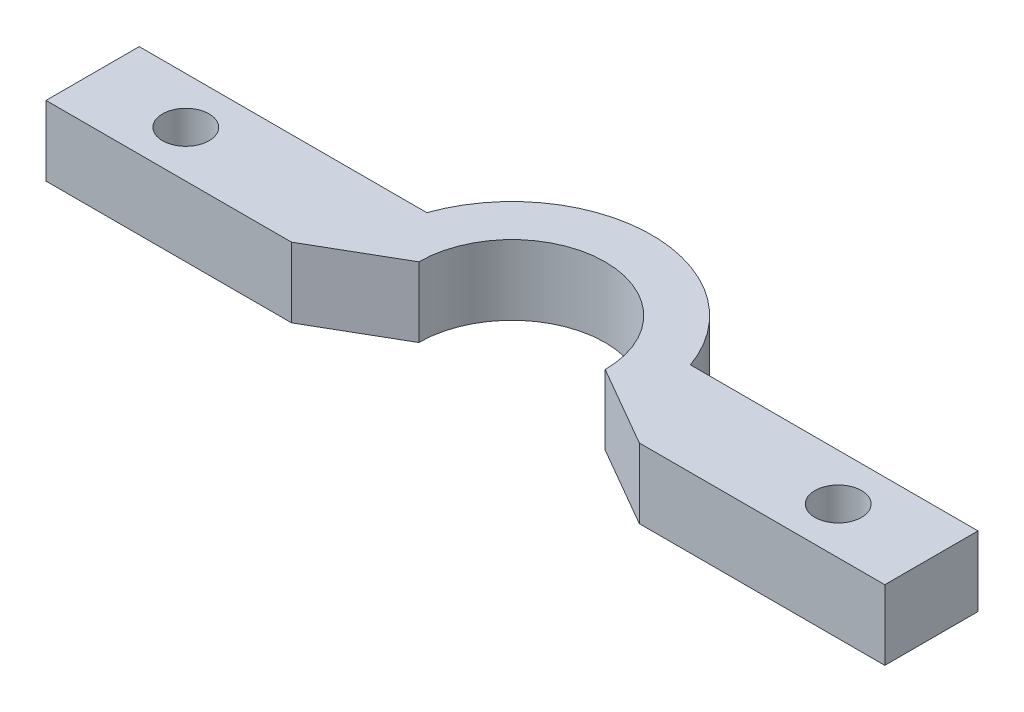
from build123d import *

# Parameters (mm, degrees)
SKETCH1_R           = 0.79375
BOSS_EXTRUDE1_DEPTH = 1.190625


with BuildPart() as part:
    # Sketch1 → Boss-Extrude1 (new, symmetric)
    # profile 1 of 7: a face of its own
    with BuildSketch(Plane(origin=(0, 0, 0), x_dir=(1, 0, 0), z_dir=(0, 1, 0))):
        with BuildLine():
            ThreePointArc((-4.682314967, -0.870248702), (-4.742411374, -0.436967517), (-4.7625, 0))
            ThreePointArc((-4.7625, 0), (-4.69391314, 0.805348174), (-4.490128061, 1.5875))
            Line((-4.490128061, 1.5875), (-14.2875, 1.5875))
            Line((-14.2875, 1.5875), (-14.2875, -1.5875))
            Line((-14.2875, -1.5875), (-5.924630657, -1.5875))
            Line((-5.924630657, -1.5875), (-4.682314967, -0.870248702))
        make_face()
        with Locations(Location((-11.1125, 0, 0), (0, 0, 90))):
            Circle(SKETCH1_R, mode=Mode.SUBTRACT)
    # profile 2 of 7: a face of its own
    with BuildSketch(Plane(origin=(0, 0, 0), x_dir=(1, 0, 0), z_dir=(0, 1, 0))):
        with BuildLine():
            Line((-4.7625, 0), (-3.175, 0))
            ThreePointArc((-3.175, 0), (-3.066814498, 0.821750468), (-2.749630657, 1.5875))
            Line((-2.749630657, 1.5875), (-4.490128061, 1.5875))
            ThreePointArc((-4.490128061, 1.5875), (-4.69391314, 0.805348174), (-4.7625, 0))
        make_face()
    # profile 3 of 7: a face of its own
    with BuildSketch(Plane(origin=(0, 0, 0), x_dir=(1, 0, 0), z_dir=(0, 1, 0))):
        with BuildLine():
            ThreePointArc((-2.749630657, 1.5875), (0, 3.175), (2.749630657, 1.5875))
            Line((2.749630657, 1.5875), (4.490128061, 1.5875))
            ThreePointArc((4.490128061, 1.5875), (0, 4.7625), (-4.490128061, 1.5875))
            Line((-4.490128061, 1.5875), (-2.749630657, 1.5875))
        make_face()
    # profile 4 of 7: a face of its own
    with BuildSketch(Plane(origin=(0, 0, 0), x_dir=(1, 0, 0), z_dir=(0, 1, 0))):
        with BuildLine():
            ThreePointArc((2.749630657, 1.5875), (3.066814498, 0.821750468), (3.175, 0))
            Line((3.175, 0), (4.7625, 0))
            ThreePointArc((4.7625, 0), (4.69391314, 0.805348174), (4.490128061, 1.5875))
            Line((4.490128061, 1.5875), (2.749630657, 1.5875))
        make_face()
    # profile 5 of 7: a face of its own
    with BuildSketch(Plane(origin=(0, 0, 0), x_dir=(1, 0, 0), z_dir=(0, 1, 0))):
        with BuildLine():
            ThreePointArc((4.490128061, 1.5875), (4.69391314, 0.805348174), (4.7625, 0))
            ThreePointArc((4.7625, 0), (4.742411374, -0.436967517), (4.682314967, -0.870248702))
            Line((4.682314967, -0.870248702), (5.924630657, -1.5875))
            Line((5.924630657, -1.5875), (14.2875, -1.5875))
            Line((14.2875, -1.5875), (14.2875, 1.5875))
            Line((14.2875, 1.5875), (4.490128061, 1.5875))
        make_face()
        with Locations(Location((11.1125, 0, 0), (0, 0, 90))):
            Circle(SKETCH1_R, mode=Mode.SUBTRACT)
    # profile 6 of 7: a face of its own
    with BuildSketch(Plane(origin=(0, 0, 0), x_dir=(1, 0, 0), z_dir=(0, 1, 0))):
        with BuildLine():
            Line((-4.682314967, -0.870248702), (-3.175, 0))
            Line((-3.175, 0), (-4.7625, 0))
            ThreePointArc((-4.7625, 0), (-4.742411374, -0.436967517), (-4.682314967, -0.870248702))
        make_face()
    # profile 7 of 7: a face of its own
    with BuildSketch(Plane(origin=(0, 0, 0), x_dir=(1, 0, 0), z_dir=(0, 1, 0))):
        with BuildLine():
            Line((4.7625, 0), (3.175, 0))
            Line((3.175, 0), (4.682314967, -0.870248702))
            ThreePointArc((4.682314967, -0.870248702), (4.742411374, -0.436967517), (4.7625, 0))
        make_face()
    extrude(amount=BOSS_EXTRUDE1_DEPTH, both=True)


solid = part.part
